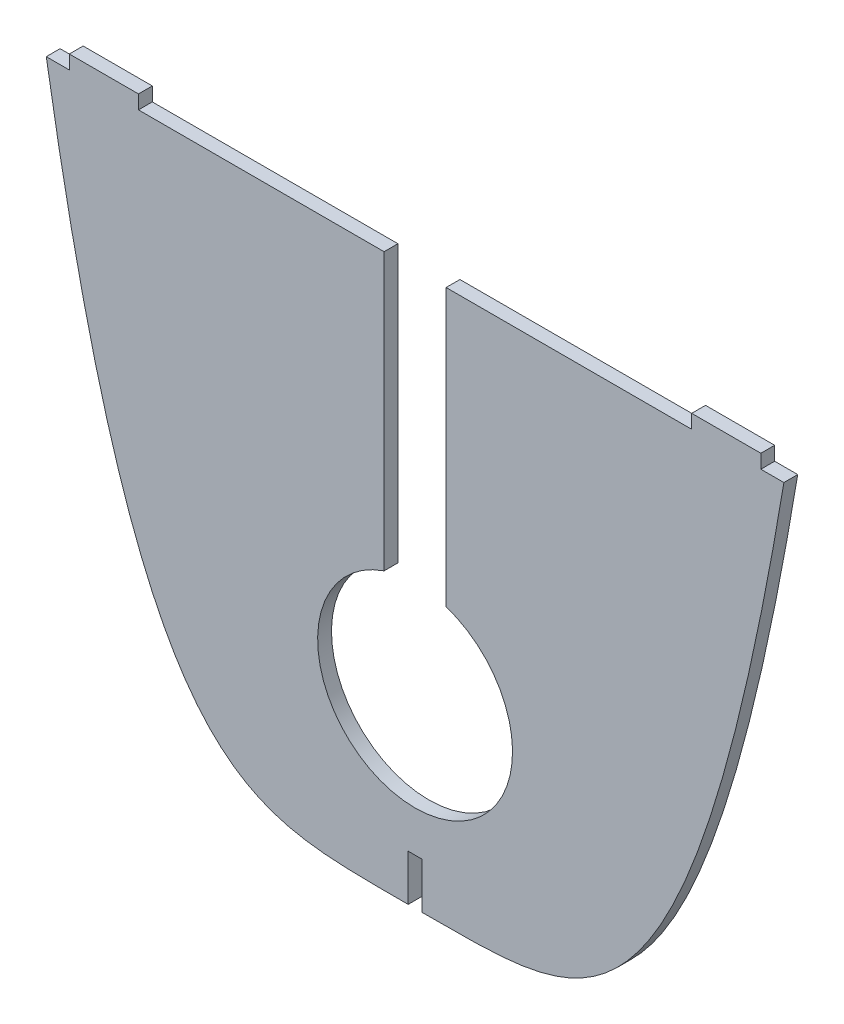
from build123d import *

# Parameters (mm, degrees)
EXTRUDE_1_DEPTH     = 3
EXTRUDE_2_DEPTH     = 3
SKETCH_3_W          = 13.450237246
SKETCH_3_H          = 65.000975664
CUT_EXTRUDE_1_DEPTH = 3
SKETCH_4_R          = 21.136087039
CUT_EXTRUDE_2_DEPTH = 3
SKETCH_5_W          = 3
SKETCH_5_H          = 15.975910133
CUT_EXTRUDE_4_DEPTH = 10


with BuildPart() as part:
    # 草图1 → 凸台-拉伸1 (new body)
    with BuildSketch(Plane.XY):
        with BuildLine():
            Line((-80.000000005, 119.999999901), (-75.000000001, 119.999999901))
            Line((-75.000000001, 119.999999901), (-75.000000001, 123.000000024))
            Line((-75.000000001, 123.000000024), (-60, 123.000000024))
            Line((-60, 123.000000024), (-60, 120.000000041))
            Line((-60, 120.000000041), (-55, 120.000000041))
            add(Edge.make_bspline(
                [(-55, 120.000000041), (-34.848967069, 68.706461628), (-14.697934131, 54.999024377)],
                knots=[0, 0, 0, 0.366382417, 0.366382417, 0.366382417], degree=2))
            ThreePointArc((-14.697934131, 54.999024377), (1e-09, 19), (14.69793413, 54.999024379))
            add(Edge.make_bspline(
                [(14.69793413, 54.999024379), (34.848967062, 68.706461624), (55, 119.999999995)],
                knots=[0.633617583, 0.633617583, 0.633617583, 1, 1, 1], degree=2))
            Line((55, 119.999999995), (60, 119.999999995))
            Line((60, 119.999999995), (60, 123.000000213))
            Line((60, 123.000000213), (75.00000006, 123.000000213))
            Line((75.00000006, 123.000000213), (75.00000006, 120.000000262))
            Line((75.00000006, 120.000000262), (80.000000064, 120.000000262))
            add(Edge.make_bspline(
                [(-80.000000005, 119.999999901), (-39.999999975, -120.000000248), (2.9e-08, 120.000000083), (40.000000059, -120.000000419), (80.000000064, 120.000000262)],
                knots=[0.028854322, 0.028854322, 0.028854322, 0.028854322, 0.028854322, 0.971145678, 0.971145678, 0.971145678, 0.971145678, 0.971145678], degree=4))
        make_face()
    extrude(amount=EXTRUDE_1_DEPTH)

    # 草图2 → 凸台-拉伸2 (add)
    with BuildSketch(Plane.XY):
        with BuildLine():
            Line((-55, 120.000000041), (55, 119.999999995))
            add(Edge.make_bspline(
                [(14.69793413, 54.999024379), (34.848967062, 68.706461624), (55, 119.999999995)],
                knots=[0, 0, 0, 1, 1, 1], degree=2))
            Line((14.69793413, 54.999024379), (-14.697934131, 54.999024377))
            add(Edge.make_bspline(
                [(-55, 120.000000041), (-34.848967069, 68.706461628), (-14.697934131, 54.999024377)],
                knots=[0, 0, 0, 1, 1, 1], degree=2))
        make_face()
    extrude(amount=EXTRUDE_2_DEPTH)

    # 草图3 → 切除-拉伸1 (cut)
    with BuildSketch(Plane.XY):
        with Locations((0, 87.499512209)):
            Rectangle(SKETCH_3_W, SKETCH_3_H)
    extrude(amount=CUT_EXTRUDE_1_DEPTH, mode=Mode.SUBTRACT)

    # 草图4 → 切除-拉伸2 (cut)
    with BuildSketch(Plane.XY):
        with Locations((0, 40)):
            Circle(SKETCH_4_R)
    extrude(amount=CUT_EXTRUDE_2_DEPTH, mode=Mode.SUBTRACT)

    # 草图5 → 切除-拉伸4 (cut)
    with BuildSketch(Plane.XY.offset(3)):
        with Locations((0, 2.012044933)):
            Rectangle(SKETCH_5_W, SKETCH_5_H)
    extrude(amount=-CUT_EXTRUDE_4_DEPTH, mode=Mode.SUBTRACT)


solid = part.part
